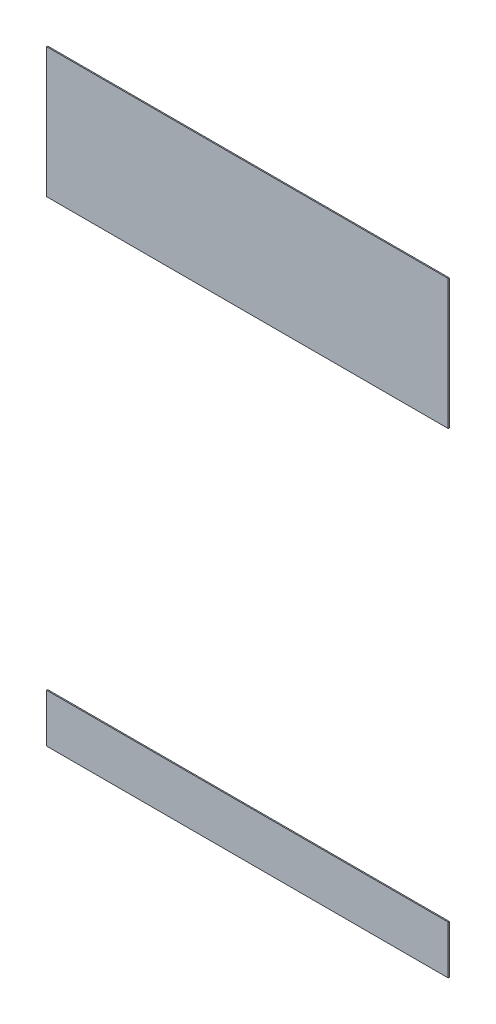
from build123d import *

# Parameters (mm, degrees)
SKETCH_4_W      = 360
SKETCH_4_H      = 116.5
EXTRUDE_2_DEPTH = 1
SKETCH_5_W      = 359.999999999
SKETCH_5_H      = 43.394548122
EXTRUDE_3_DEPTH = 1


with BuildPart() as part:
    # 草图4 → 凸台-拉伸2 (new body)
    with BuildSketch(Plane.XY):
        with Locations((-189.999999924, 506.750000035)):
            Rectangle(SKETCH_4_W, SKETCH_4_H)
    extrude(amount=-EXTRUDE_2_DEPTH)


with BuildPart() as body_2:
    # 草图5 → 凸台-拉伸3 (new body)
    with BuildSketch(Plane.XY):
        with Locations((-189.999999924, 43.697274061)):
            Rectangle(SKETCH_5_W, SKETCH_5_H)
    extrude(amount=-EXTRUDE_3_DEPTH)


solid = Compound([part.part, body_2.part])
